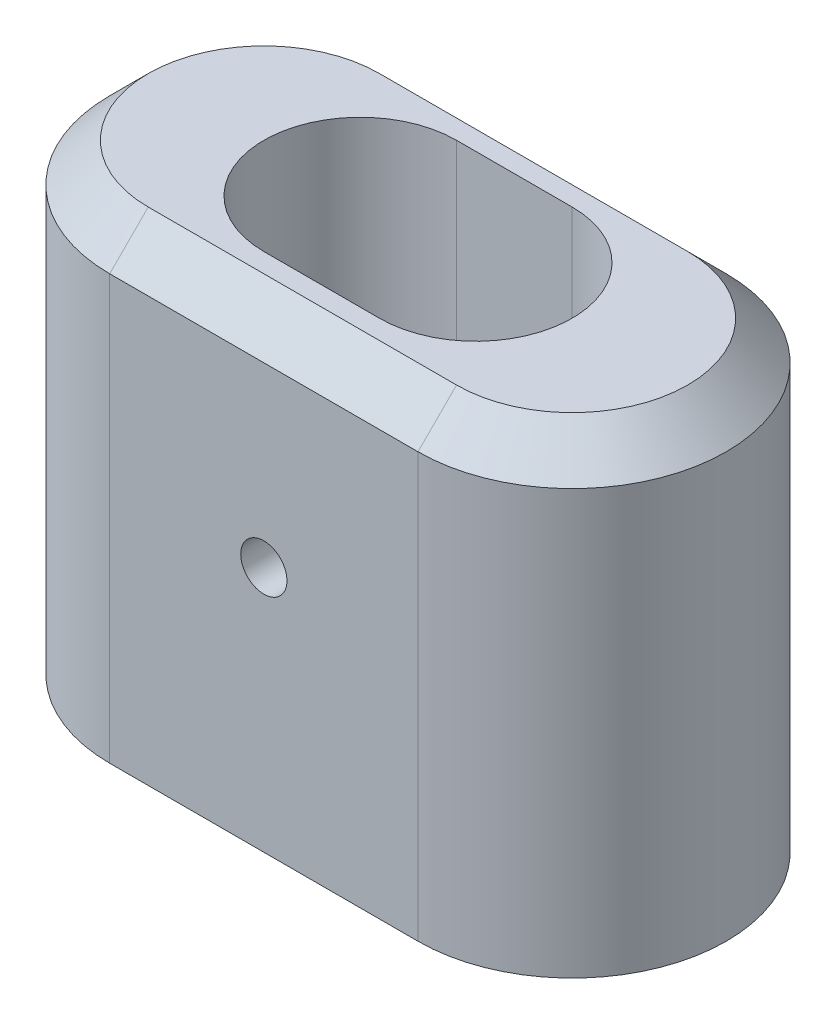
from build123d import *

# Parameters (mm, degrees)
BOSS_EXTRUDE1_DEPTH = 60
CHAMFER1_SIZE       = 5
SKETCH3_R           = 3
CUT_EXTRUDE1_DEPTH  = 83.462112512


with BuildPart() as part:
    # Sketch2 → Boss-Extrude1 (new body)
    with BuildSketch(Plane(origin=(0, 0, 0), x_dir=(1, 0, 0), z_dir=(0, 1, 0))):
        with BuildLine():
            Line((-20, 20), (20, 20))
            ThreePointArc((20, 20), (40, 0), (20, -20))
            Line((20, -20), (-20, -20))
            ThreePointArc((-20, -20), (-40, 0), (-20, 20))
        make_face()
        with BuildLine():
            Line((7.5, 12.5), (-7.5, 12.5))
            ThreePointArc((-7.5, 12.5), (-20, 0), (-7.5, -12.5))
            Line((-7.5, -12.5), (7.5, -12.5))
            ThreePointArc((7.5, -12.5), (20, 0), (7.5, 12.5))
        make_face(mode=Mode.SUBTRACT)
    extrude(amount=BOSS_EXTRUDE1_DEPTH)

    # Chamfer1
    chamfer1_edges = [part.edges().sort_by_distance(p)[0] for p in [
        (40, 60, 0),
        (0, 60, -20),
        (-40, 60, 0),
        (0, 60, 20),
    ]]
    chamfer(chamfer1_edges, length=CHAMFER1_SIZE)

    # Sketch3 → Cut-Extrude1 (cut, through all)
    with BuildSketch(Plane(origin=(0, 0, -20), x_dir=(-1, 0, 0), z_dir=(0, 0, -1))):
        with Locations((0, 32)):
            Circle(SKETCH3_R)
    extrude(amount=-CUT_EXTRUDE1_DEPTH, mode=Mode.SUBTRACT)


solid = part.part
